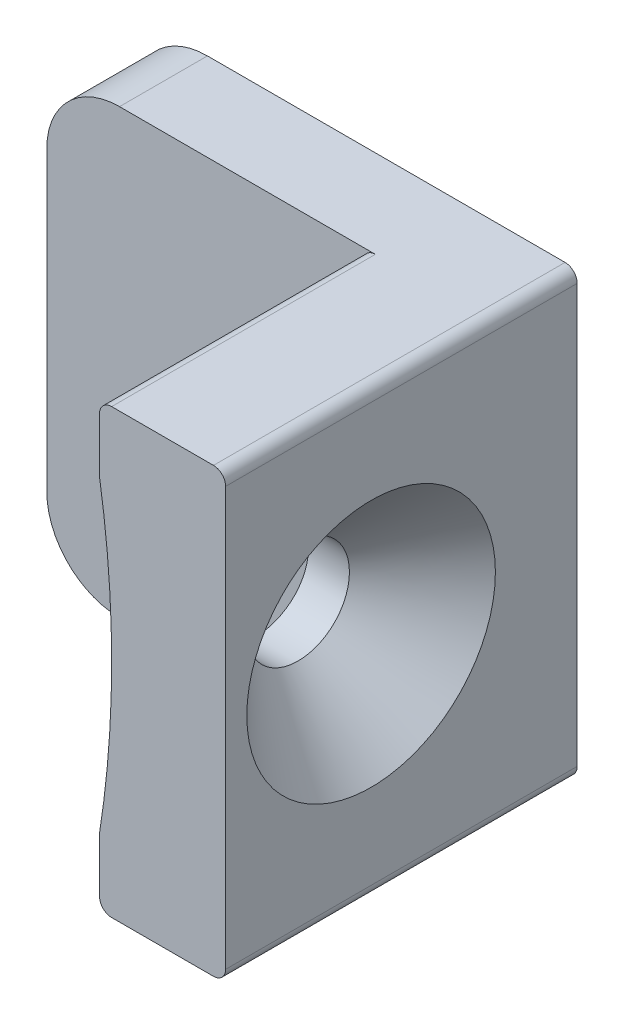
from build123d import *

# Parameters (mm, degrees)
BOSS_EXTRUDE1_DEPTH                             = 9.271
CUT_EXTRUDE1_DEPTH                              = 24.491224021
CSK_FOR_M4_FLAT_HEAD_MACHINE_SCREW1_D           = 4.3
CSK_FOR_M4_FLAT_HEAD_MACHINE_SCREW1_CSINK_D     = 10.416
CSK_FOR_M4_FLAT_HEAD_MACHINE_SCREW1_CSINK_ANGLE = 90
FILLET2_R                                       = 3.048
FILLET3_R                                       = 0.508


with BuildPart() as part:
    # Sketch1 → Boss-Extrude1 (new, symmetric)
    with BuildSketch(Plane(origin=(0, 0, 0), x_dir=(1, 0, 0), z_dir=(0, 1, 0))):
        Polygon((-18.542, 4.953), (-7.62, 4.953), (-7.62, -6.096), (0, -6.096), (0, 8.636), (-18.542, 8.636), align=None)
    extrude(amount=BOSS_EXTRUDE1_DEPTH, both=True)

    # Sketch2 → Cut-Extrude1 (cut, through all)
    with BuildSketch(Plane(origin=(0, 0, -4.953), x_dir=(-1, 0, 0), z_dir=(0, 0, -1))):
        with BuildLine():
            Line((5.2832, 6.46179195), (5.2832, 15.24))
            Line((5.2832, 15.24), (52.002170663, 15.24))
            Line((52.002170663, 15.24), (52.002170663, -15.24))
            Line((52.002170663, -15.24), (5.2832, -15.24))
            Line((5.2832, -15.24), (5.2832, -6.46179195))
            ThreePointArc((5.2832, -6.46179195), (4.7752, 0), (5.2832, 6.46179195))
        make_face()
    extrude(amount=-CUT_EXTRUDE1_DEPTH, mode=Mode.SUBTRACT)

    # CSK for M4 Flat Head Machine Screw1 (through all)
    with Locations(Plane(origin=(0, 0, 0), x_dir=(0, 0, -1), z_dir=(1, 0, 0))):
        with Locations((0, 0)):
            CounterSinkHole(CSK_FOR_M4_FLAT_HEAD_MACHINE_SCREW1_D / 2, CSK_FOR_M4_FLAT_HEAD_MACHINE_SCREW1_CSINK_D / 2, counter_sink_angle=CSK_FOR_M4_FLAT_HEAD_MACHINE_SCREW1_CSINK_ANGLE)

    # Sketch5 → #6-32 Tapped Hole1 (revolve, cut)
    with BuildSketch(Plane(origin=(-12.7, -3.175, -8.636), x_dir=(0, 1, 0), z_dir=(1, 0, 0))):
        Polygon((0, 0), (0, 3.683), (1.905, 3.683), (1.35255, 3.13055), (1.35255, 0.55245), (1.905, 0), align=None)
    revolve(axis=Axis((-12.7, -3.175, -14.986), (0, 0, 1)), mode=Mode.SUBTRACT)

    # Fillet2
    fillet2_edges = [part.edges().sort_by_distance(p)[0] for p in [
        (-18.542, 9.271, -6.7945),
        (-18.542, -9.271, -6.7945),
    ]]
    fillet(fillet2_edges, radius=FILLET2_R)

    # Fillet3
    fillet3_edges = [part.edges().sort_by_distance(p)[0] for p in [
        (-5.2832, -9.271, 0.5715),
        (-5.2832, 9.271, 0.5715),
        (0, 9.271, -1.27),
        (0, -9.271, -1.27),
    ]]
    fillet(fillet3_edges, radius=FILLET3_R)


solid = part.part
